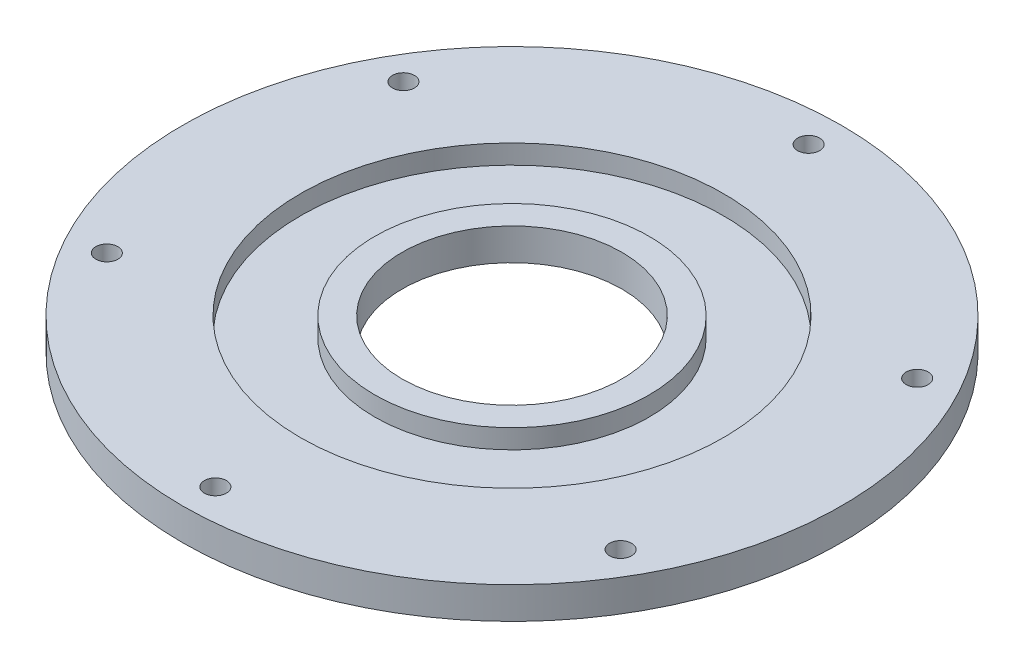
from build123d import *

# Parameters (mm, degrees)
SKETCH1_R           = 60
SKETCH1_R_2         = 20
BOSS_EXTRUDE1_DEPTH = 5.8
SKETCH2_R           = 38.5
SKETCH2_R_2         = 25
CUT_EXTRUDE1_DEPTH  = 3.5
SKETCH3_R           = 2
CUT_EXTRUDE2_DEPTH  = 86.050808344


with BuildPart() as part:
    # Sketch1 → Boss-Extrude1 (new body)
    with BuildSketch(Plane(origin=(0, 0, 0), x_dir=(1, 0, 0), z_dir=(0, 1, 0))):
        with Locations(Location((0, 0, 0), (0, 0, 270))):
            Circle(SKETCH1_R)
        with Locations(Location((0, 0, 0), (0, 0, 270))):
            Circle(SKETCH1_R_2, mode=Mode.SUBTRACT)
    extrude(amount=BOSS_EXTRUDE1_DEPTH)

    # Sketch2 → Cut-Extrude1 (cut)
    with BuildSketch(Plane(origin=(0, 5.8, 0), x_dir=(1, 0, 0), z_dir=(0, 1, 0))):
        with Locations(Location((0, 0, 0), (0, 0, 270))):
            Circle(SKETCH2_R)
        with Locations(Location((0, 0, 0), (0, 0, 270))):
            Circle(SKETCH2_R_2, mode=Mode.SUBTRACT)
    extrude(amount=-CUT_EXTRUDE1_DEPTH, mode=Mode.SUBTRACT)

    # Sketch3 → Cut-Extrude2 (cut, through all)
    with BuildSketch(Plane(origin=(0, 5.8, 0), x_dir=(1, 0, 0), z_dir=(0, 1, 0))):
        with Locations(Location((0, 54, 0), (0, 0, 270))):
            Circle(SKETCH3_R)
        with Locations(Location((46.765371804, 27, 0), (0, 0, 270))):
            Circle(SKETCH3_R)
        with Locations(Location((46.765371804, -27, 0), (0, 0, 270))):
            Circle(SKETCH3_R)
        with Locations(Location((0, -54, 0), (0, 0, 270))):
            Circle(SKETCH3_R)
        with Locations(Location((-46.765371804, -27, 0), (0, 0, 270))):
            Circle(SKETCH3_R)
        with Locations(Location((-46.765371804, 27, 0), (0, 0, 270))):
            Circle(SKETCH3_R)
    extrude(amount=-CUT_EXTRUDE2_DEPTH, mode=Mode.SUBTRACT)


solid = part.part
